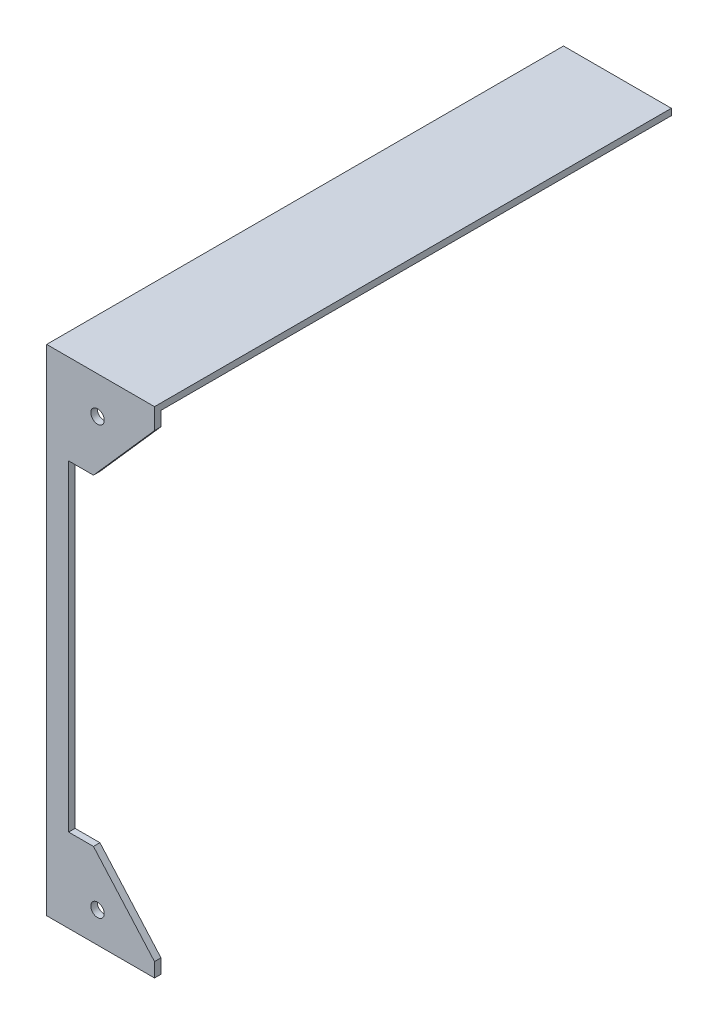
from build123d import *

# Parameters (mm, degrees)
BOSS_EXTRUDE1_DEPTH = 1.5875
SKETCH2_W           = 26.5
SKETCH2_H           = 127
BOSS_EXTRUDE2_DEPTH = 1.5875


with BuildPart() as part:
    # Sketch1 → Boss-Extrude1 (new body)
    with BuildSketch(Plane.XY):
        Polygon((-250, 120), (-223.5, 120), (-223.5, 116.5), (-238.5, 99.5), (-244.6, 99.5), (-244.6, 20.5), (-238.5, 20.5), (-223.5, 3.5), (-223.5, 0), (-250, 0), align=None)
        with BuildLine():
            ThreePointArc((-239.15, 112.5), (-237.5, 110.85), (-235.85, 112.5))
            ThreePointArc((-235.85, 112.5), (-237.5, 114.15), (-239.15, 112.5))
        make_face(mode=Mode.SUBTRACT)
        with BuildLine():
            ThreePointArc((-235.85, 7.5), (-237.5, 9.15), (-239.15, 7.5))
            ThreePointArc((-239.15, 7.5), (-237.5, 5.85), (-235.85, 7.5))
        make_face(mode=Mode.SUBTRACT)
    extrude(amount=BOSS_EXTRUDE1_DEPTH)

    # Sketch2 → Boss-Extrude2 (add)
    with BuildSketch(Plane(origin=(0, 120, 0), x_dir=(1, 0, 0), z_dir=(0, 1, 0))):
        with Locations((-236.75, 61.9125)):
            Rectangle(SKETCH2_W, SKETCH2_H)
    extrude(amount=BOSS_EXTRUDE2_DEPTH)


solid = part.part
